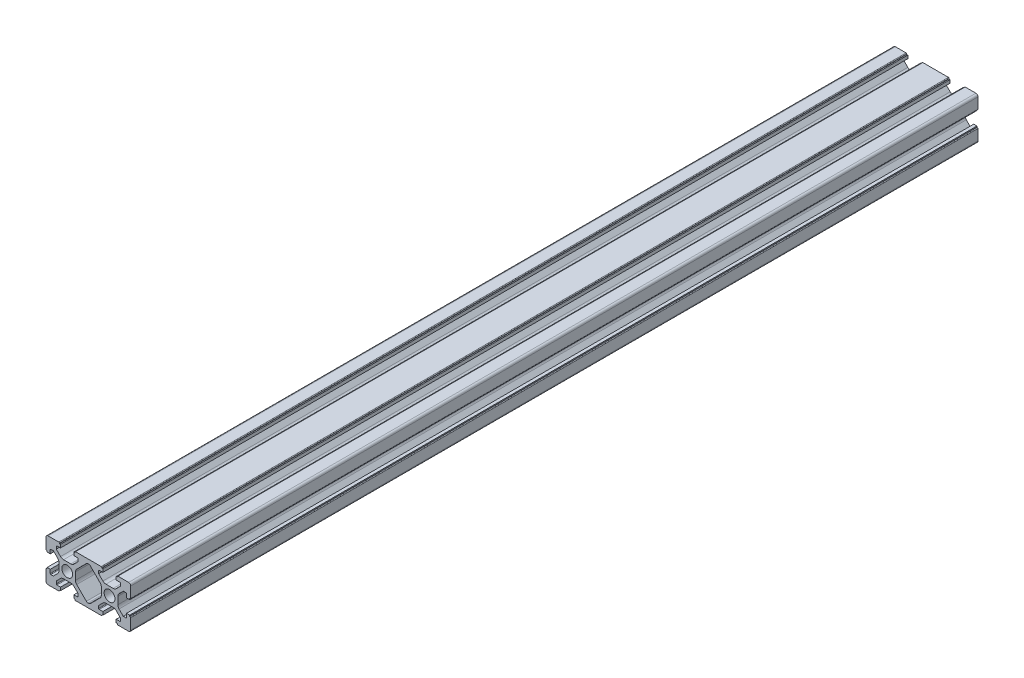
from build123d import *

# Parameters (mm, degrees)
CROQUIS1_R              = 2.55
SALIENTE_EXTRUIR1_DEPTH = 400


with BuildPart() as part:
    # Croquis1 → Saliente-Extruir1 (new body)
    with BuildSketch(Plane.XY):
        with BuildLine():
            Line((-20, -9), (-20, -3.95))
            ThreePointArc((-20, -3.95), (-19.912132034, -3.737867966), (-19.7, -3.65))
            Line((-19.7, -3.65), (-19.5, -3.65))
            Line((-19.5, -3.65), (-19.5, -3.15))
            Line((-19.5, -3.15), (-18, -3.15))
            Line((-18, -3.15), (-18, -4.85))
            ThreePointArc((-18, -4.85), (-17.912132034, -5.062132034), (-17.7, -5.15))
            Line((-17.7, -5.15), (-16.5, -5.15))
            Line((-16.5, -5.15), (-14.485786438, -3.135786438))
            ThreePointArc((-14.485786438, -3.135786438), (-14.052240935, -2.48693974), (-13.9, -1.721572875))
            Line((-13.9, -1.721572875), (-13.9, 1.721572875))
            ThreePointArc((-13.9, 1.721572875), (-14.052240935, 2.48693974), (-14.485786438, 3.135786438))
            Line((-14.485786438, 3.135786438), (-16.5, 5.15))
            Line((-16.5, 5.15), (-17.7, 5.15))
            ThreePointArc((-17.7, 5.15), (-17.912132034, 5.062132034), (-18, 4.85))
            Line((-18, 4.85), (-18, 3.15))
            Line((-18, 3.15), (-19.5, 3.15))
            Line((-19.5, 3.15), (-19.5, 3.65))
            Line((-19.5, 3.65), (-19.7, 3.65))
            ThreePointArc((-19.7, 3.65), (-19.912132034, 3.737867966), (-20, 3.95))
            Line((-20, 3.95), (-20, 9))
            ThreePointArc((-20, 9), (-19.707106781, 9.707106781), (-19, 10))
            Line((-19, 10), (-13.95, 10))
            ThreePointArc((-13.95, 10), (-13.737867966, 9.912132034), (-13.65, 9.7))
            Line((-13.65, 9.7), (-13.65, 9.5))
            Line((-13.65, 9.5), (-13.15, 9.5))
            Line((-13.15, 9.5), (-13.15, 8))
            Line((-13.15, 8), (-14.85, 8))
            ThreePointArc((-14.85, 8), (-15.062132034, 7.912132034), (-15.15, 7.7))
            Line((-15.15, 7.7), (-15.15, 6.5))
            Line((-15.15, 6.5), (-13.135786438, 4.485786438))
            ThreePointArc((-13.135786438, 4.485786438), (-12.48693974, 4.052240935), (-11.721572875, 3.9))
            Line((-11.721572875, 3.9), (-8.278427125, 3.9))
            ThreePointArc((-8.278427125, 3.9), (-7.51306026, 4.052240935), (-6.864213562, 4.485786438))
            Line((-6.864213562, 4.485786438), (-4.85, 6.5))
            Line((-4.85, 6.5), (-4.85, 7.7))
            ThreePointArc((-4.85, 7.7), (-4.937867966, 7.912132034), (-5.15, 8))
            Line((-5.15, 8), (-6.85, 8))
            Line((-6.85, 8), (-6.85, 9.5))
            Line((-6.85, 9.5), (-6.35, 9.5))
            Line((-6.35, 9.5), (-6.35, 9.7))
            ThreePointArc((-6.35, 9.7), (-6.262132034, 9.912132034), (-6.05, 10))
            Line((-6.05, 10), (6.05, 10))
            ThreePointArc((6.05, 10), (6.262132034, 9.912132034), (6.35, 9.7))
            Line((6.35, 9.7), (6.35, 9.5))
            Line((6.35, 9.5), (6.85, 9.5))
            Line((6.85, 9.5), (6.85, 8))
            Line((6.85, 8), (5.15, 8))
            ThreePointArc((5.15, 8), (4.937867966, 7.912132034), (4.85, 7.7))
            Line((4.85, 7.7), (4.85, 6.5))
            Line((4.85, 6.5), (6.864213562, 4.485786438))
            ThreePointArc((6.864213562, 4.485786438), (7.51306026, 4.052240935), (8.278427125, 3.9))
            Line((8.278427125, 3.9), (11.721572875, 3.9))
            ThreePointArc((11.721572875, 3.9), (12.48693974, 4.052240935), (13.135786438, 4.485786438))
            Line((13.135786438, 4.485786438), (15.15, 6.5))
            Line((15.15, 6.5), (15.15, 7.7))
            ThreePointArc((15.15, 7.7), (15.062132034, 7.912132034), (14.85, 8))
            Line((14.85, 8), (13.15, 8))
            Line((13.15, 8), (13.15, 9.5))
            Line((13.15, 9.5), (13.65, 9.5))
            Line((13.65, 9.5), (13.65, 9.7))
            ThreePointArc((13.65, 9.7), (13.737867966, 9.912132034), (13.95, 10))
            Line((13.95, 10), (19, 10))
            ThreePointArc((19, 10), (19.707106781, 9.707106781), (20, 9))
            Line((20, 9), (20, 3.95))
            ThreePointArc((20, 3.95), (19.912132034, 3.737867966), (19.7, 3.65))
            Line((19.7, 3.65), (19.5, 3.65))
            Line((19.5, 3.65), (19.5, 3.15))
            Line((19.5, 3.15), (18, 3.15))
            Line((18, 3.15), (18, 4.85))
            ThreePointArc((18, 4.85), (17.912132034, 5.062132034), (17.7, 5.15))
            Line((17.7, 5.15), (16.5, 5.15))
            Line((16.5, 5.15), (14.485786438, 3.135786438))
            ThreePointArc((14.485786438, 3.135786438), (14.052240935, 2.48693974), (13.9, 1.721572875))
            Line((13.9, 1.721572875), (13.9, -1.721572875))
            ThreePointArc((13.9, -1.721572875), (14.052240935, -2.48693974), (14.485786438, -3.135786438))
            Line((14.485786438, -3.135786438), (16.5, -5.15))
            Line((16.5, -5.15), (17.7, -5.15))
            ThreePointArc((17.7, -5.15), (17.912132034, -5.062132034), (18, -4.85))
            Line((18, -4.85), (18, -3.15))
            Line((18, -3.15), (19.5, -3.15))
            Line((19.5, -3.15), (19.5, -3.65))
            Line((19.5, -3.65), (19.7, -3.65))
            ThreePointArc((19.7, -3.65), (19.912132034, -3.737867966), (20, -3.95))
            Line((20, -3.95), (20, -9))
            ThreePointArc((20, -9), (19.707106781, -9.707106781), (19, -10))
            Line((19, -10), (13.65, -10))
            Line((13.65, -10), (13.65, -9.5))
            Line((13.65, -9.5), (13.15, -9.5))
            Line((13.15, -9.5), (13.15, -8))
            Line((13.15, -8), (14.85, -8))
            ThreePointArc((14.85, -8), (15.062132034, -7.912132034), (15.15, -7.7))
            Line((15.15, -7.7), (15.15, -6.5))
            Line((15.15, -6.5), (13.135786438, -4.485786438))
            ThreePointArc((13.135786438, -4.485786438), (12.48693974, -4.052240935), (11.721572875, -3.9))
            Line((11.721572875, -3.9), (8.278427125, -3.9))
            ThreePointArc((8.278427125, -3.9), (7.51306026, -4.052240935), (6.864213562, -4.485786438))
            Line((6.864213562, -4.485786438), (4.85, -6.5))
            Line((4.85, -6.5), (4.85, -7.7))
            ThreePointArc((4.85, -7.7), (4.937867966, -7.912132034), (5.15, -8))
            Line((5.15, -8), (6.85, -8))
            Line((6.85, -8), (6.85, -9.5))
            Line((6.85, -9.5), (6.35, -9.5))
            Line((6.35, -9.5), (6.35, -9.7))
            ThreePointArc((6.35, -9.7), (6.262132034, -9.912132034), (6.05, -10))
            Line((6.05, -10), (0, -10))
            Line((0, -10), (-6.05, -10))
            ThreePointArc((-6.05, -10), (-6.262132034, -9.912132034), (-6.35, -9.7))
            Line((-6.35, -9.7), (-6.35, -9.5))
            Line((-6.35, -9.5), (-6.85, -9.5))
            Line((-6.85, -9.5), (-6.85, -8))
            Line((-6.85, -8), (-5.15, -8))
            ThreePointArc((-5.15, -8), (-4.937867966, -7.912132034), (-4.85, -7.7))
            Line((-4.85, -7.7), (-4.85, -6.5))
            Line((-4.85, -6.5), (-6.864213562, -4.485786438))
            ThreePointArc((-6.864213562, -4.485786438), (-7.51306026, -4.052240935), (-8.278427125, -3.9))
            Line((-8.278427125, -3.9), (-11.721572875, -3.9))
            ThreePointArc((-11.721572875, -3.9), (-12.48693974, -4.052240935), (-13.135786438, -4.485786438))
            Line((-13.135786438, -4.485786438), (-15.15, -6.5))
            Line((-15.15, -6.5), (-15.15, -7.7))
            ThreePointArc((-15.15, -7.7), (-15.062132034, -7.912132034), (-14.85, -8))
            Line((-14.85, -8), (-13.15, -8))
            Line((-13.15, -8), (-13.15, -9.5))
            Line((-13.15, -9.5), (-13.65, -9.5))
            Line((-13.65, -9.5), (-13.65, -9.7))
            ThreePointArc((-13.65, -9.7), (-13.737867966, -9.912132034), (-13.95, -10))
            Line((-13.95, -10), (-19, -10))
            ThreePointArc((-19, -10), (-19.707106781, -9.707106781), (-20, -9))
        make_face()
        with Locations((-10, 0)):
            Circle(CROQUIS1_R, mode=Mode.SUBTRACT)
        with Locations((10, 0)):
            Circle(CROQUIS1_R, mode=Mode.SUBTRACT)
        with BuildLine():
            Line((-6.1, 1.721572875), (-6.1, -1.721572875))
            ThreePointArc((-6.1, -1.721572875), (-5.947759065, -2.48693974), (-5.514213562, -3.135786438))
            Line((-5.514213562, -3.135786438), (-3.5, -5.15))
            Line((-3.5, -5.15), (-0.942893219, -7.707106781))
            ThreePointArc((-0.942893219, -7.707106781), (-0.61846987, -7.923879533), (-0.235786438, -8))
            Line((-0.235786438, -8), (0.235786438, -8))
            ThreePointArc((0.235786438, -8), (0.61846987, -7.923879533), (0.942893219, -7.707106781))
            Line((0.942893219, -7.707106781), (3.5, -5.15))
            Line((3.5, -5.15), (5.514213562, -3.135786438))
            ThreePointArc((5.514213562, -3.135786438), (5.947759065, -2.48693974), (6.1, -1.721572875))
            Line((6.1, -1.721572875), (6.1, 1.721572875))
            ThreePointArc((6.1, 1.721572875), (5.947759065, 2.48693974), (5.514213562, 3.135786438))
            Line((5.514213562, 3.135786438), (3.5, 5.15))
            Line((3.5, 5.15), (0.942893219, 7.707106781))
            ThreePointArc((0.942893219, 7.707106781), (0.61846987, 7.923879533), (0.235786438, 8))
            Line((0.235786438, 8), (-0.235786438, 8))
            ThreePointArc((-0.235786438, 8), (-0.61846987, 7.923879533), (-0.942893219, 7.707106781))
            Line((-0.942893219, 7.707106781), (-3.5, 5.15))
            Line((-3.5, 5.15), (-5.514213562, 3.135786438))
            ThreePointArc((-5.514213562, 3.135786438), (-5.947759065, 2.48693974), (-6.1, 1.721572875))
        make_face(mode=Mode.SUBTRACT)
    extrude(amount=SALIENTE_EXTRUIR1_DEPTH)


solid = part.part
